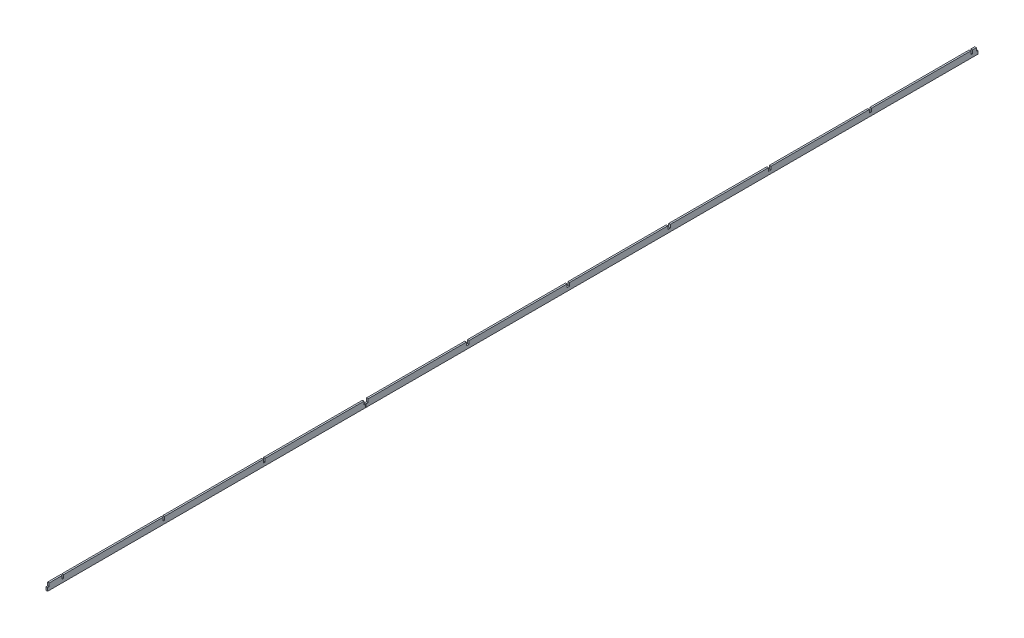
from build123d import *

# Parameters (mm, degrees)
SKETCH_1_W          = 2
SKETCH_1_H          = 8
EXTRUDE_1_DEPTH     = 1155
SKETCH_2_W          = 2
SKETCH_2_H          = 4.041229023
SKETCH_2_W_2        = 3
SKETCH_2_H_2        = 4
CUT_EXTRUDE_1_DEPTH = 1100.022913046
SKETCH_3_W          = 1
SKETCH_3_H          = 4.041229023
EXTRUDE_2_DEPTH     = 2


with BuildPart() as part:
    # 草图1 → 凸台-拉伸1 (new body)
    with BuildSketch(Plane.XY.offset(-55.99)):
        with Locations((85.037619105, 0.937944836)):
            Rectangle(SKETCH_1_W, SKETCH_1_H)
    extrude(amount=EXTRUDE_1_DEPTH)

    # 草图2 → 切除-拉伸1 (cut, through all)
    with BuildSketch(Plane(origin=(86.037619105, 0, 0), x_dir=(0, 0, -1), z_dir=(1, 0, 0))):
        with Locations((-1098.01, 2.917330325)):
            Rectangle(SKETCH_2_W, SKETCH_2_H)
        with Locations((-1080.01, 2.917330325)):
            Rectangle(SKETCH_2_W, SKETCH_2_H)
        with Locations((-955.01, 2.917330325)):
            Rectangle(SKETCH_2_W, SKETCH_2_H)
        with Locations((-830.01, 2.917330325)):
            Rectangle(SKETCH_2_W, SKETCH_2_H)
        Polygon((-706.01, 0.896715813), (-704.11, 0.896715813), (-704.01, 0.896715813), (-704.01, 4.937944836), (-706.01, 4.937944836), align=None)
        Polygon((-704.01, 0.896715813), (-703.91, 0.896715813), (-701.01, 0.896715813), (-701.01, 4.937944836), (-704.01, 4.937944836), align=None)
        with Locations((-577.51, 2.917330325)):
            Rectangle(SKETCH_2_W_2, SKETCH_2_H)
        with Locations((-452.51, 2.917330325)):
            Rectangle(SKETCH_2_W_2, SKETCH_2_H)
        with Locations((-327.51, 2.917330325)):
            Rectangle(SKETCH_2_W_2, SKETCH_2_H)
        with Locations((-202.51, 2.917330325)):
            Rectangle(SKETCH_2_W_2, SKETCH_2_H)
        with Locations((-77.51, 2.917330325)):
            Rectangle(SKETCH_2_W_2, SKETCH_2_H)
        with Locations((47.49, 2.917330325)):
            Rectangle(SKETCH_2_W_2, SKETCH_2_H)
        with Locations((54.99, 2.937944836)):
            Rectangle(SKETCH_2_W, SKETCH_2_H_2)
        Polygon((-704.11, -3.062055164), (-703.91, -3.062055164), (-703.91, 0.896715813), (-704.01, 0.896715813), (-704.11, 0.896715813), align=None)
    extrude(amount=-CUT_EXTRUDE_1_DEPTH, mode=Mode.SUBTRACT)


with BuildPart() as cut_extrude_1_piece_1:
    # of the separate pieces the step leaves, piece 1, a body of its own (cut_extrude_1_pieces)
    add(part.part.solids().sort_by_distance((86.037619105, -3.062055164, -55.99))[0])

    # 草图3 → 凸台-拉伸2 (add)
    with BuildSketch(Plane(origin=(86.037619105, 0, 0), x_dir=(0, 0, -1), z_dir=(1, 0, 0))):
        with Locations((46.49, 2.917330325)):
            Rectangle(SKETCH_3_W, SKETCH_3_H)
    extrude(amount=-EXTRUDE_2_DEPTH)


with BuildPart() as cut_extrude_1_piece_2:
    # of the separate pieces the step leaves, piece 2, a body of its own (cut_extrude_1_pieces)
    add(part.part.solids().sort_by_distance((86.037619105, -3.062055164, 704.11))[0])


solid = Compound([cut_extrude_1_piece_1.part, cut_extrude_1_piece_2.part])
